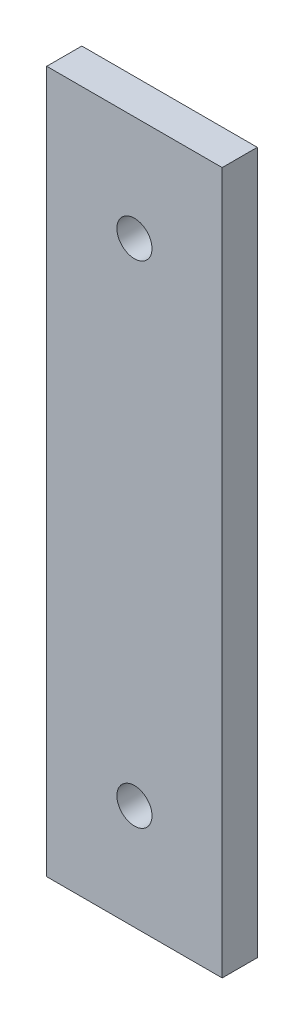
from build123d import *

# Parameters (mm, degrees)
SKETCH1_W           = 25
SKETCH1_H           = 100
BOSS_EXTRUDE1_DEPTH = 5
SKETCH2_R           = 2.5
CUT_EXTRUDE1_DEPTH  = 10


with BuildPart() as part:
    # Sketch1 → Boss-Extrude1 (new body)
    with BuildSketch(Plane.XY):
        with Locations((12.5, 15.159574468)):
            Rectangle(SKETCH1_W, SKETCH1_H)
    extrude(amount=BOSS_EXTRUDE1_DEPTH)

    # Sketch2 → Cut-Extrude1 (cut)
    with BuildSketch(Plane.XY.offset(5)):
        with Locations((12.5, 50.159574468)):
            Circle(SKETCH2_R)
        with Locations((12.5, -19.840425532)):
            Circle(SKETCH2_R)
    extrude(amount=-CUT_EXTRUDE1_DEPTH, mode=Mode.SUBTRACT)


solid = part.part
